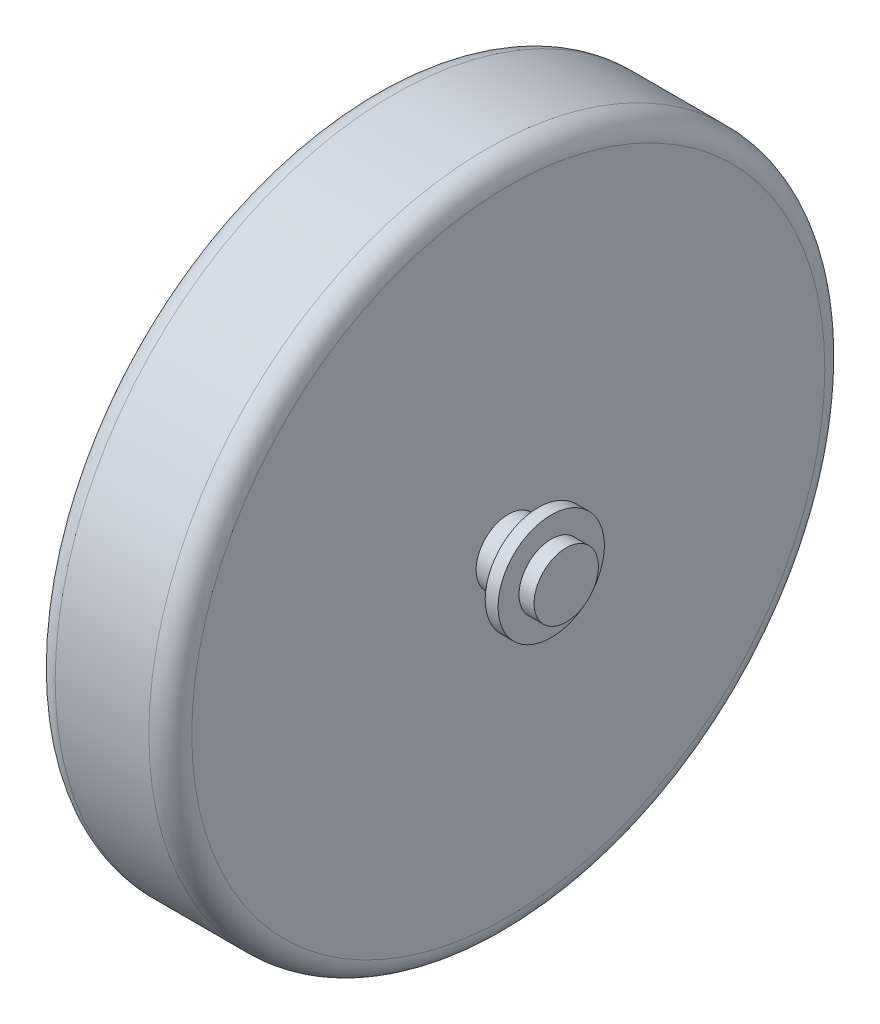
from build123d import *

# Parameters (mm, degrees)
FILLET1_R          = 10
SKETCH2_R          = 3.175
CUT_EXTRUDE1_DEPTH = 10


with BuildPart() as part:
    # Sketch1 → Revolve1 (revolve)
    with BuildSketch(Plane(origin=(0, 0, 0), x_dir=(1, 0, 0), z_dir=(0, 1, 0)), mode=Mode.PRIVATE) as revolve1_sk:
        Polygon((-27, 157.5), (-27, 15), (-13, 15), (-13, 24.765749007), (-7, 24.765749007), (-7, 15), (0, 15), (0, 0), (-119, 0), (-119, 47), (-97, 47), (-97, 63.5), (-90.65, 63.5), (-90.65, 157.5), align=None)
    revolve(revolve1_sk.sketch.rotate(Axis((-119, 0, 0), (1, 0, 0)), 180), axis=Axis((-119, 0, 0), (1, 0, 0)))

    # Fillet1
    fillet1_edges = [part.edges().sort_by_distance(p)[0] for p in [
        (-27, 0, -157.5),
        (-90.65, 0, -157.5),
    ]]
    fillet(fillet1_edges, radius=FILLET1_R)

    # Sketch2 → Cut-Extrude1 (cut)
    with BuildSketch(Plane.ZY.offset(97)):
        with Locations((0, 58)):
            Circle(SKETCH2_R)
        with Locations((50.229473419, 29)):
            Circle(SKETCH2_R)
        with Locations((50.229473419, -29)):
            Circle(SKETCH2_R)
        with Locations((0, -58)):
            Circle(SKETCH2_R)
        with Locations((-50.22947342, -29)):
            Circle(SKETCH2_R)
        with Locations((-50.229473419, 29)):
            Circle(SKETCH2_R)
    extrude(amount=-CUT_EXTRUDE1_DEPTH, mode=Mode.SUBTRACT)


solid = part.part
